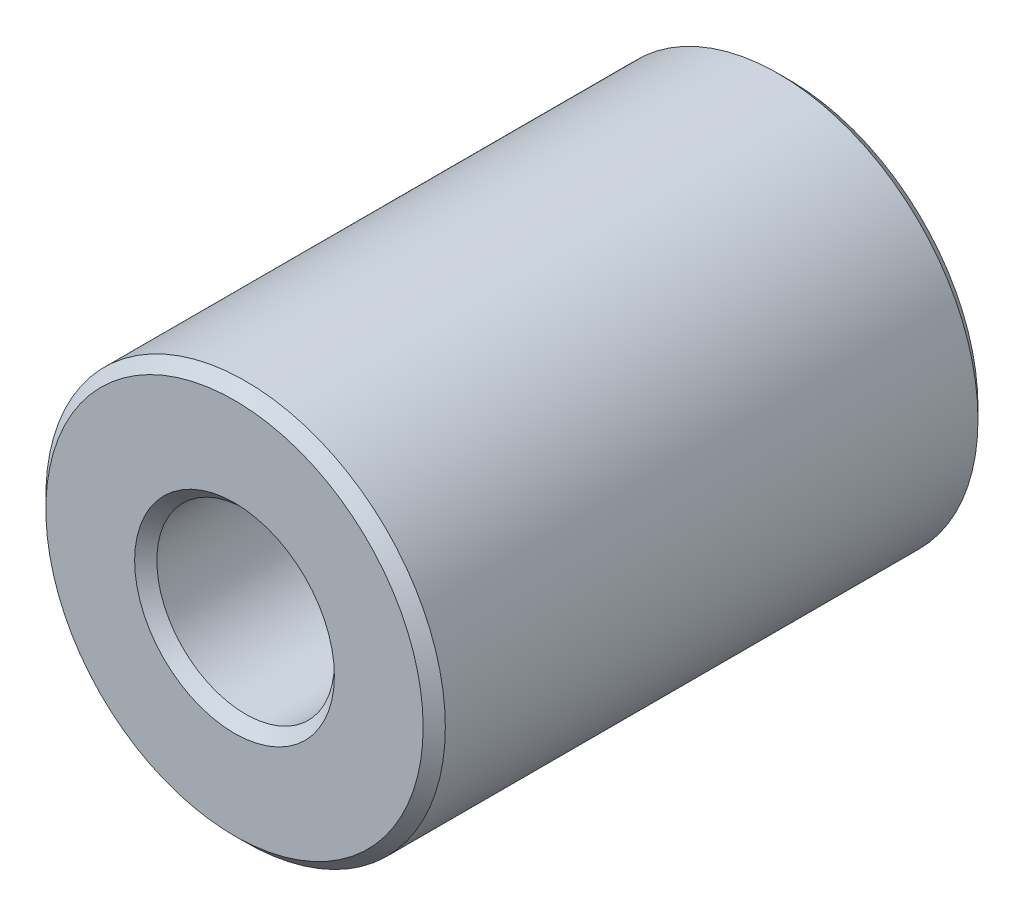
from build123d import *

# Parameters (mm, degrees)
SZKIC1_R                    = 9
DODANIE_WYCI_GNI_CIE1_DEPTH = 25
SZKIC2_R                    = 4
WYTNIJ_WYCI_GNI_CIE1_DEPTH  = 10
SZKIC3_R                    = 2.5
WYTNIJ_WYCI_GNI_CIE2_DEPTH  = 10
SFAZOWANIE1_SIZE            = 0.5


with BuildPart() as part:
    # Szkic1 → Dodanie-wyciągnięcie1 (new body)
    with BuildSketch(Plane.XY):
        Circle(SZKIC1_R)
    extrude(amount=DODANIE_WYCI_GNI_CIE1_DEPTH)

    # Szkic2 → Wytnij-wyciągnięcie1 (cut)
    with BuildSketch(Plane.XY.offset(25)):
        Circle(SZKIC2_R)
    extrude(amount=-WYTNIJ_WYCI_GNI_CIE1_DEPTH, mode=Mode.SUBTRACT)

    # Szkic3 → Wytnij-wyciągnięcie2 (cut)
    with BuildSketch(Plane(origin=(0, 0, 0), x_dir=(-1, 0, 0), z_dir=(0, 0, -1))):
        Circle(SZKIC3_R)
    extrude(amount=-WYTNIJ_WYCI_GNI_CIE2_DEPTH, mode=Mode.SUBTRACT)

    # Sfazowanie1
    sfazowanie1_edges = [part.edges().sort_by_distance(p)[0] for p in [
        (2.5, 0, 0),
        (-9, 0, 0),
        (-9, 0, 25),
        (-4, 0, 25),
    ]]
    chamfer(sfazowanie1_edges, length=SFAZOWANIE1_SIZE)


solid = part.part
